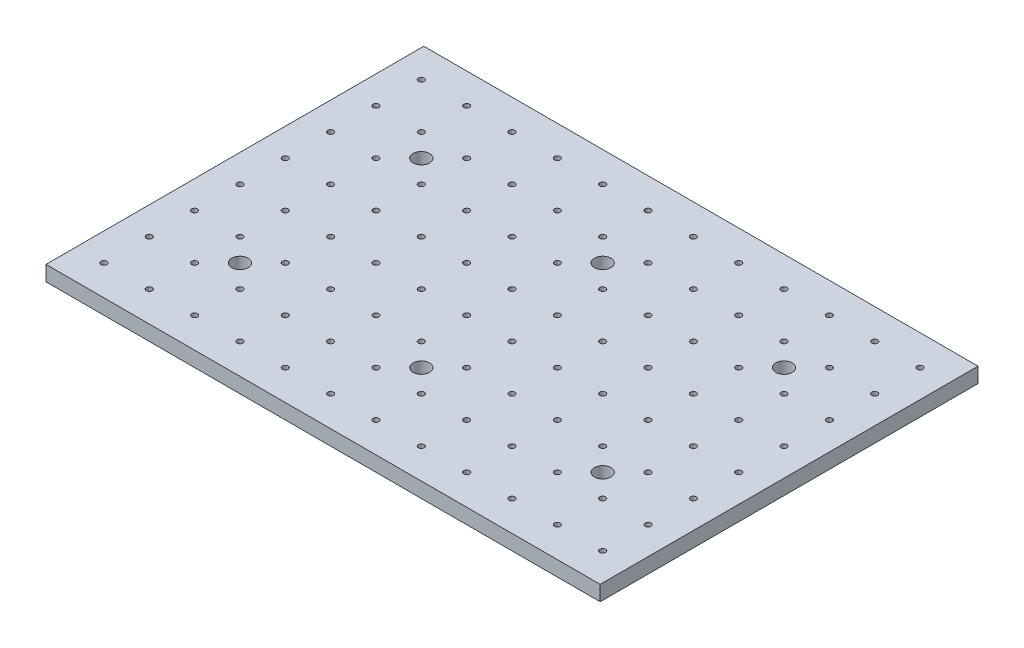
from build123d import *

# Parameters (mm, degrees)
SKETCH1_W                = 110
SKETCH1_H                = 75
BOSS_EXTRUDE1_DEPTH      = 3
SKETCH2_R                = 0.575
CUT_EXTRUDE2_DEPTH       = 67.635200908
LPATTERN1_COUNT          = 6
LPATTERN1_PITCH          = 9
LPATTERN1_COUNT_DIR2     = 4
LPATTERN1_PITCH_DIR2     = 9
MIRROR1_COPY_1_SKETCH_R  = 0.575
MIRROR1_COPY_1_DEPTH     = 67.635200908
MIRROR1_COPY_2_SKETCH_R  = 0.575
MIRROR1_COPY_2_DEPTH     = 67.635200908
MIRROR1_COPY_3_SKETCH_R  = 0.575
MIRROR1_COPY_3_DEPTH     = 67.635200908
MIRROR1_COPY_4_SKETCH_R  = 0.575
MIRROR1_COPY_4_DEPTH     = 67.635200908
MIRROR1_COPY_5_SKETCH_R  = 0.575
MIRROR1_COPY_5_DEPTH     = 67.635200908
MIRROR1_COPY_6_SKETCH_R  = 0.575
MIRROR1_COPY_6_DEPTH     = 67.635200908
MIRROR1_COPY_7_SKETCH_R  = 0.575
MIRROR1_COPY_7_DEPTH     = 67.635200908
MIRROR1_COPY_8_SKETCH_R  = 0.575
MIRROR1_COPY_8_DEPTH     = 67.635200908
MIRROR1_COPY_9_SKETCH_R  = 0.575
MIRROR1_COPY_9_DEPTH     = 67.635200908
MIRROR1_COPY_10_SKETCH_R = 0.575
MIRROR1_COPY_10_DEPTH    = 67.635200908
MIRROR1_COPY_11_SKETCH_R = 0.575
MIRROR1_COPY_11_DEPTH    = 67.635200908
MIRROR1_COPY_12_SKETCH_R = 0.575
MIRROR1_COPY_12_DEPTH    = 67.635200908
MIRROR1_COPY_13_SKETCH_R = 0.575
MIRROR1_COPY_13_DEPTH    = 67.635200908
MIRROR1_COPY_14_SKETCH_R = 0.575
MIRROR1_COPY_14_DEPTH    = 67.635200908
MIRROR1_COPY_15_SKETCH_R = 0.575
MIRROR1_COPY_15_DEPTH    = 67.635200908
MIRROR1_COPY_16_SKETCH_R = 0.575
MIRROR1_COPY_16_DEPTH    = 67.635200908
MIRROR1_COPY_17_SKETCH_R = 0.575
MIRROR1_COPY_17_DEPTH    = 67.635200908
MIRROR1_COPY_18_SKETCH_R = 0.575
MIRROR1_COPY_18_DEPTH    = 67.635200908
MIRROR1_COPY_19_SKETCH_R = 0.575
MIRROR1_COPY_19_DEPTH    = 67.635200908
MIRROR1_COPY_20_SKETCH_R = 0.575
MIRROR1_COPY_20_DEPTH    = 67.635200908
MIRROR1_COPY_21_SKETCH_R = 0.575
MIRROR1_COPY_21_DEPTH    = 67.635200908
MIRROR1_COPY_22_SKETCH_R = 0.575
MIRROR1_COPY_22_DEPTH    = 67.635200908
MIRROR1_COPY_23_SKETCH_R = 0.575
MIRROR1_COPY_23_DEPTH    = 67.635200908
MIRROR2_COPY_1_SKETCH_R  = 0.575
MIRROR2_COPY_1_DEPTH     = 67.635200908
MIRROR2_COPY_2_SKETCH_R  = 0.575
MIRROR2_COPY_2_DEPTH     = 67.635200908
MIRROR2_COPY_3_SKETCH_R  = 0.575
MIRROR2_COPY_3_DEPTH     = 67.635200908
MIRROR2_COPY_4_SKETCH_R  = 0.575
MIRROR2_COPY_4_DEPTH     = 67.635200908
MIRROR2_COPY_5_SKETCH_R  = 0.575
MIRROR2_COPY_5_DEPTH     = 67.635200908
MIRROR2_COPY_6_SKETCH_R  = 0.575
MIRROR2_COPY_6_DEPTH     = 67.635200908
MIRROR2_COPY_7_SKETCH_R  = 0.575
MIRROR2_COPY_7_DEPTH     = 67.635200908
MIRROR2_COPY_8_SKETCH_R  = 0.575
MIRROR2_COPY_8_DEPTH     = 67.635200908
MIRROR2_COPY_9_SKETCH_R  = 0.575
MIRROR2_COPY_9_DEPTH     = 67.635200908
MIRROR2_COPY_10_SKETCH_R = 0.575
MIRROR2_COPY_10_DEPTH    = 67.635200908
MIRROR2_COPY_11_SKETCH_R = 0.575
MIRROR2_COPY_11_DEPTH    = 67.635200908
MIRROR2_COPY_12_SKETCH_R = 0.575
MIRROR2_COPY_12_DEPTH    = 67.635200908
MIRROR2_COPY_13_SKETCH_R = 0.575
MIRROR2_COPY_13_DEPTH    = 67.635200908
MIRROR2_COPY_14_SKETCH_R = 0.575
MIRROR2_COPY_14_DEPTH    = 67.635200908
MIRROR2_COPY_15_SKETCH_R = 0.575
MIRROR2_COPY_15_DEPTH    = 67.635200908
MIRROR2_COPY_16_SKETCH_R = 0.575
MIRROR2_COPY_16_DEPTH    = 67.635200908
MIRROR2_COPY_17_SKETCH_R = 0.575
MIRROR2_COPY_17_DEPTH    = 67.635200908
MIRROR2_COPY_18_SKETCH_R = 0.575
MIRROR2_COPY_18_DEPTH    = 67.635200908
MIRROR2_COPY_19_SKETCH_R = 0.575
MIRROR2_COPY_19_DEPTH    = 67.635200908
MIRROR2_COPY_20_SKETCH_R = 0.575
MIRROR2_COPY_20_DEPTH    = 67.635200908
MIRROR2_COPY_21_SKETCH_R = 0.575
MIRROR2_COPY_21_DEPTH    = 67.635200908
MIRROR2_COPY_22_SKETCH_R = 0.575
MIRROR2_COPY_22_DEPTH    = 67.635200908
MIRROR2_COPY_23_SKETCH_R = 0.575
MIRROR2_COPY_23_DEPTH    = 67.635200908
MIRROR2_COPY_24_SKETCH_R = 0.575
MIRROR2_COPY_24_DEPTH    = 67.635200908
MIRROR2_COPY_25_SKETCH_R = 0.575
MIRROR2_COPY_25_DEPTH    = 67.635200908
MIRROR2_COPY_26_SKETCH_R = 0.575
MIRROR2_COPY_26_DEPTH    = 67.635200908
MIRROR2_COPY_27_SKETCH_R = 0.575
MIRROR2_COPY_27_DEPTH    = 67.635200908
MIRROR2_COPY_28_SKETCH_R = 0.575
MIRROR2_COPY_28_DEPTH    = 67.635200908
MIRROR2_COPY_29_SKETCH_R = 0.575
MIRROR2_COPY_29_DEPTH    = 67.635200908
MIRROR2_COPY_30_SKETCH_R = 0.575
MIRROR2_COPY_30_DEPTH    = 67.635200908
MIRROR2_COPY_31_SKETCH_R = 0.575
MIRROR2_COPY_31_DEPTH    = 67.635200908
MIRROR2_COPY_32_SKETCH_R = 0.575
MIRROR2_COPY_32_DEPTH    = 67.635200908
MIRROR2_COPY_33_SKETCH_R = 0.575
MIRROR2_COPY_33_DEPTH    = 67.635200908
MIRROR2_COPY_34_SKETCH_R = 0.575
MIRROR2_COPY_34_DEPTH    = 67.635200908
MIRROR2_COPY_35_SKETCH_R = 0.575
MIRROR2_COPY_35_DEPTH    = 67.635200908
MIRROR2_COPY_36_SKETCH_R = 0.575
MIRROR2_COPY_36_DEPTH    = 67.635200908
MIRROR2_COPY_37_SKETCH_R = 0.575
MIRROR2_COPY_37_DEPTH    = 67.635200908
MIRROR2_COPY_38_SKETCH_R = 0.575
MIRROR2_COPY_38_DEPTH    = 67.635200908
MIRROR2_COPY_39_SKETCH_R = 0.575
MIRROR2_COPY_39_DEPTH    = 67.635200908
MIRROR2_COPY_40_SKETCH_R = 0.575
MIRROR2_COPY_40_DEPTH    = 67.635200908
MIRROR2_COPY_41_SKETCH_R = 0.575
MIRROR2_COPY_41_DEPTH    = 67.635200908
MIRROR2_COPY_42_SKETCH_R = 0.575
MIRROR2_COPY_42_DEPTH    = 67.635200908
MIRROR2_COPY_43_SKETCH_R = 0.575
MIRROR2_COPY_43_DEPTH    = 67.635200908
MIRROR2_COPY_44_SKETCH_R = 0.575
MIRROR2_COPY_44_DEPTH    = 67.635200908
MIRROR2_COPY_45_SKETCH_R = 0.575
MIRROR2_COPY_45_DEPTH    = 67.635200908
MIRROR2_COPY_46_SKETCH_R = 0.575
MIRROR2_COPY_46_DEPTH    = 67.635200908
MIRROR2_COPY_47_SKETCH_R = 0.575
MIRROR2_COPY_47_DEPTH    = 67.635200908
F_4_CLEARANCE_HOLE1_D    = 3.2639


with BuildPart() as part:
    # Sketch1 → Boss-Extrude1 (new body)
    with BuildSketch(Plane(origin=(0, 0, 0), x_dir=(1, 0, 0), z_dir=(0, 1, 0))):
        Rectangle(SKETCH1_W, SKETCH1_H)
    extrude(amount=BOSS_EXTRUDE1_DEPTH)

    # Sketch2 → Cut-Extrude2 (cut, through all)
    with BuildSketch(Plane(origin=(0, 0, 0), x_dir=(1, 0, 0), z_dir=(0, 1, 0))):
        with Locations((-4.5, 4.5)):
            Circle(SKETCH2_R)
    cut_extrude2 = extrude(amount=CUT_EXTRUDE2_DEPTH, mode=Mode.SUBTRACT)

    # LPattern1: Cut-Extrude2 6 × 4
    with Locations(*[(-i * LPATTERN1_PITCH, 0, -j * LPATTERN1_PITCH_DIR2) for i in range(LPATTERN1_COUNT) for j in range(LPATTERN1_COUNT_DIR2) if (i, j) != (0, 0)]):
        add(cut_extrude2, mode=Mode.SUBTRACT)

    # Mirror1: Cut-Extrude2 across plane
    add(cut_extrude2.mirror(Plane.XY), mode=Mode.SUBTRACT)

    # Mirror1 copy 1 sketch → Mirror1 copy 1 (cut, through all)
    with BuildSketch(Plane(origin=(0, 0, 9), x_dir=(1, 0, 0), z_dir=(0, 1, 0))):
        with Locations((-4.5, -4.5)):
            Circle(MIRROR1_COPY_1_SKETCH_R)
    extrude(amount=MIRROR1_COPY_1_DEPTH, mode=Mode.SUBTRACT)

    # Mirror1 copy 2 sketch → Mirror1 copy 2 (cut, through all)
    with BuildSketch(Plane(origin=(0, 0, 18), x_dir=(1, 0, 0), z_dir=(0, 1, 0))):
        with Locations((-4.5, -4.5)):
            Circle(MIRROR1_COPY_2_SKETCH_R)
    extrude(amount=MIRROR1_COPY_2_DEPTH, mode=Mode.SUBTRACT)

    # Mirror1 copy 3 sketch → Mirror1 copy 3 (cut, through all)
    with BuildSketch(Plane(origin=(0, 0, 27), x_dir=(1, 0, 0), z_dir=(0, 1, 0))):
        with Locations((-4.5, -4.5)):
            Circle(MIRROR1_COPY_3_SKETCH_R)
    extrude(amount=MIRROR1_COPY_3_DEPTH, mode=Mode.SUBTRACT)

    # Mirror1 copy 4 sketch → Mirror1 copy 4 (cut, through all)
    with BuildSketch(Plane(origin=(-9, 0, 0), x_dir=(1, 0, 0), z_dir=(0, 1, 0))):
        with Locations((-4.5, -4.5)):
            Circle(MIRROR1_COPY_4_SKETCH_R)
    extrude(amount=MIRROR1_COPY_4_DEPTH, mode=Mode.SUBTRACT)

    # Mirror1 copy 5 sketch → Mirror1 copy 5 (cut, through all)
    with BuildSketch(Plane(origin=(-9, 0, 9), x_dir=(1, 0, 0), z_dir=(0, 1, 0))):
        with Locations((-4.5, -4.5)):
            Circle(MIRROR1_COPY_5_SKETCH_R)
    extrude(amount=MIRROR1_COPY_5_DEPTH, mode=Mode.SUBTRACT)

    # Mirror1 copy 6 sketch → Mirror1 copy 6 (cut, through all)
    with BuildSketch(Plane(origin=(-9, 0, 18), x_dir=(1, 0, 0), z_dir=(0, 1, 0))):
        with Locations((-4.5, -4.5)):
            Circle(MIRROR1_COPY_6_SKETCH_R)
    extrude(amount=MIRROR1_COPY_6_DEPTH, mode=Mode.SUBTRACT)

    # Mirror1 copy 7 sketch → Mirror1 copy 7 (cut, through all)
    with BuildSketch(Plane(origin=(-9, 0, 27), x_dir=(1, 0, 0), z_dir=(0, 1, 0))):
        with Locations((-4.5, -4.5)):
            Circle(MIRROR1_COPY_7_SKETCH_R)
    extrude(amount=MIRROR1_COPY_7_DEPTH, mode=Mode.SUBTRACT)

    # Mirror1 copy 8 sketch → Mirror1 copy 8 (cut, through all)
    with BuildSketch(Plane(origin=(-18, 0, 0), x_dir=(1, 0, 0), z_dir=(0, 1, 0))):
        with Locations((-4.5, -4.5)):
            Circle(MIRROR1_COPY_8_SKETCH_R)
    extrude(amount=MIRROR1_COPY_8_DEPTH, mode=Mode.SUBTRACT)

    # Mirror1 copy 9 sketch → Mirror1 copy 9 (cut, through all)
    with BuildSketch(Plane(origin=(-18, 0, 9), x_dir=(1, 0, 0), z_dir=(0, 1, 0))):
        with Locations((-4.5, -4.5)):
            Circle(MIRROR1_COPY_9_SKETCH_R)
    extrude(amount=MIRROR1_COPY_9_DEPTH, mode=Mode.SUBTRACT)

    # Mirror1 copy 10 sketch → Mirror1 copy 10 (cut, through all)
    with BuildSketch(Plane(origin=(-18, 0, 18), x_dir=(1, 0, 0), z_dir=(0, 1, 0))):
        with Locations((-4.5, -4.5)):
            Circle(MIRROR1_COPY_10_SKETCH_R)
    extrude(amount=MIRROR1_COPY_10_DEPTH, mode=Mode.SUBTRACT)

    # Mirror1 copy 11 sketch → Mirror1 copy 11 (cut, through all)
    with BuildSketch(Plane(origin=(-18, 0, 27), x_dir=(1, 0, 0), z_dir=(0, 1, 0))):
        with Locations((-4.5, -4.5)):
            Circle(MIRROR1_COPY_11_SKETCH_R)
    extrude(amount=MIRROR1_COPY_11_DEPTH, mode=Mode.SUBTRACT)

    # Mirror1 copy 12 sketch → Mirror1 copy 12 (cut, through all)
    with BuildSketch(Plane(origin=(-27, 0, 0), x_dir=(1, 0, 0), z_dir=(0, 1, 0))):
        with Locations((-4.5, -4.5)):
            Circle(MIRROR1_COPY_12_SKETCH_R)
    extrude(amount=MIRROR1_COPY_12_DEPTH, mode=Mode.SUBTRACT)

    # Mirror1 copy 13 sketch → Mirror1 copy 13 (cut, through all)
    with BuildSketch(Plane(origin=(-27, 0, 9), x_dir=(1, 0, 0), z_dir=(0, 1, 0))):
        with Locations((-4.5, -4.5)):
            Circle(MIRROR1_COPY_13_SKETCH_R)
    extrude(amount=MIRROR1_COPY_13_DEPTH, mode=Mode.SUBTRACT)

    # Mirror1 copy 14 sketch → Mirror1 copy 14 (cut, through all)
    with BuildSketch(Plane(origin=(-27, 0, 18), x_dir=(1, 0, 0), z_dir=(0, 1, 0))):
        with Locations((-4.5, -4.5)):
            Circle(MIRROR1_COPY_14_SKETCH_R)
    extrude(amount=MIRROR1_COPY_14_DEPTH, mode=Mode.SUBTRACT)

    # Mirror1 copy 15 sketch → Mirror1 copy 15 (cut, through all)
    with BuildSketch(Plane(origin=(-27, 0, 27), x_dir=(1, 0, 0), z_dir=(0, 1, 0))):
        with Locations((-4.5, -4.5)):
            Circle(MIRROR1_COPY_15_SKETCH_R)
    extrude(amount=MIRROR1_COPY_15_DEPTH, mode=Mode.SUBTRACT)

    # Mirror1 copy 16 sketch → Mirror1 copy 16 (cut, through all)
    with BuildSketch(Plane(origin=(-36, 0, 0), x_dir=(1, 0, 0), z_dir=(0, 1, 0))):
        with Locations((-4.5, -4.5)):
            Circle(MIRROR1_COPY_16_SKETCH_R)
    extrude(amount=MIRROR1_COPY_16_DEPTH, mode=Mode.SUBTRACT)

    # Mirror1 copy 17 sketch → Mirror1 copy 17 (cut, through all)
    with BuildSketch(Plane(origin=(-36, 0, 9), x_dir=(1, 0, 0), z_dir=(0, 1, 0))):
        with Locations((-4.5, -4.5)):
            Circle(MIRROR1_COPY_17_SKETCH_R)
    extrude(amount=MIRROR1_COPY_17_DEPTH, mode=Mode.SUBTRACT)

    # Mirror1 copy 18 sketch → Mirror1 copy 18 (cut, through all)
    with BuildSketch(Plane(origin=(-36, 0, 18), x_dir=(1, 0, 0), z_dir=(0, 1, 0))):
        with Locations((-4.5, -4.5)):
            Circle(MIRROR1_COPY_18_SKETCH_R)
    extrude(amount=MIRROR1_COPY_18_DEPTH, mode=Mode.SUBTRACT)

    # Mirror1 copy 19 sketch → Mirror1 copy 19 (cut, through all)
    with BuildSketch(Plane(origin=(-36, 0, 27), x_dir=(1, 0, 0), z_dir=(0, 1, 0))):
        with Locations((-4.5, -4.5)):
            Circle(MIRROR1_COPY_19_SKETCH_R)
    extrude(amount=MIRROR1_COPY_19_DEPTH, mode=Mode.SUBTRACT)

    # Mirror1 copy 20 sketch → Mirror1 copy 20 (cut, through all)
    with BuildSketch(Plane(origin=(-45, 0, 0), x_dir=(1, 0, 0), z_dir=(0, 1, 0))):
        with Locations((-4.5, -4.5)):
            Circle(MIRROR1_COPY_20_SKETCH_R)
    extrude(amount=MIRROR1_COPY_20_DEPTH, mode=Mode.SUBTRACT)

    # Mirror1 copy 21 sketch → Mirror1 copy 21 (cut, through all)
    with BuildSketch(Plane(origin=(-45, 0, 9), x_dir=(1, 0, 0), z_dir=(0, 1, 0))):
        with Locations((-4.5, -4.5)):
            Circle(MIRROR1_COPY_21_SKETCH_R)
    extrude(amount=MIRROR1_COPY_21_DEPTH, mode=Mode.SUBTRACT)

    # Mirror1 copy 22 sketch → Mirror1 copy 22 (cut, through all)
    with BuildSketch(Plane(origin=(-45, 0, 18), x_dir=(1, 0, 0), z_dir=(0, 1, 0))):
        with Locations((-4.5, -4.5)):
            Circle(MIRROR1_COPY_22_SKETCH_R)
    extrude(amount=MIRROR1_COPY_22_DEPTH, mode=Mode.SUBTRACT)

    # Mirror1 copy 23 sketch → Mirror1 copy 23 (cut, through all)
    with BuildSketch(Plane(origin=(-45, 0, 27), x_dir=(1, 0, 0), z_dir=(0, 1, 0))):
        with Locations((-4.5, -4.5)):
            Circle(MIRROR1_COPY_23_SKETCH_R)
    extrude(amount=MIRROR1_COPY_23_DEPTH, mode=Mode.SUBTRACT)

    # Mirror2: Cut-Extrude2 across plane
    add(cut_extrude2.mirror(Plane(origin=(0, 0, 0), x_dir=(0, 0, 1), z_dir=(1, 0, 0))), mode=Mode.SUBTRACT)

    # Mirror2 copy 1 sketch → Mirror2 copy 1 (cut, through all)
    with BuildSketch(Plane(origin=(0, 0, -9), x_dir=(-1, 0, 0), z_dir=(0, 1, 0))):
        with Locations((-4.5, -4.5)):
            Circle(MIRROR2_COPY_1_SKETCH_R)
    extrude(amount=MIRROR2_COPY_1_DEPTH, mode=Mode.SUBTRACT)

    # Mirror2 copy 2 sketch → Mirror2 copy 2 (cut, through all)
    with BuildSketch(Plane(origin=(0, 0, -18), x_dir=(-1, 0, 0), z_dir=(0, 1, 0))):
        with Locations((-4.5, -4.5)):
            Circle(MIRROR2_COPY_2_SKETCH_R)
    extrude(amount=MIRROR2_COPY_2_DEPTH, mode=Mode.SUBTRACT)

    # Mirror2 copy 3 sketch → Mirror2 copy 3 (cut, through all)
    with BuildSketch(Plane(origin=(0, 0, -27), x_dir=(-1, 0, 0), z_dir=(0, 1, 0))):
        with Locations((-4.5, -4.5)):
            Circle(MIRROR2_COPY_3_SKETCH_R)
    extrude(amount=MIRROR2_COPY_3_DEPTH, mode=Mode.SUBTRACT)

    # Mirror2 copy 4 sketch → Mirror2 copy 4 (cut, through all)
    with BuildSketch(Plane(origin=(9, 0, 0), x_dir=(-1, 0, 0), z_dir=(0, 1, 0))):
        with Locations((-4.5, -4.5)):
            Circle(MIRROR2_COPY_4_SKETCH_R)
    extrude(amount=MIRROR2_COPY_4_DEPTH, mode=Mode.SUBTRACT)

    # Mirror2 copy 5 sketch → Mirror2 copy 5 (cut, through all)
    with BuildSketch(Plane(origin=(9, 0, -9), x_dir=(-1, 0, 0), z_dir=(0, 1, 0))):
        with Locations((-4.5, -4.5)):
            Circle(MIRROR2_COPY_5_SKETCH_R)
    extrude(amount=MIRROR2_COPY_5_DEPTH, mode=Mode.SUBTRACT)

    # Mirror2 copy 6 sketch → Mirror2 copy 6 (cut, through all)
    with BuildSketch(Plane(origin=(9, 0, -18), x_dir=(-1, 0, 0), z_dir=(0, 1, 0))):
        with Locations((-4.5, -4.5)):
            Circle(MIRROR2_COPY_6_SKETCH_R)
    extrude(amount=MIRROR2_COPY_6_DEPTH, mode=Mode.SUBTRACT)

    # Mirror2 copy 7 sketch → Mirror2 copy 7 (cut, through all)
    with BuildSketch(Plane(origin=(9, 0, -27), x_dir=(-1, 0, 0), z_dir=(0, 1, 0))):
        with Locations((-4.5, -4.5)):
            Circle(MIRROR2_COPY_7_SKETCH_R)
    extrude(amount=MIRROR2_COPY_7_DEPTH, mode=Mode.SUBTRACT)

    # Mirror2 copy 8 sketch → Mirror2 copy 8 (cut, through all)
    with BuildSketch(Plane(origin=(18, 0, 0), x_dir=(-1, 0, 0), z_dir=(0, 1, 0))):
        with Locations((-4.5, -4.5)):
            Circle(MIRROR2_COPY_8_SKETCH_R)
    extrude(amount=MIRROR2_COPY_8_DEPTH, mode=Mode.SUBTRACT)

    # Mirror2 copy 9 sketch → Mirror2 copy 9 (cut, through all)
    with BuildSketch(Plane(origin=(18, 0, -9), x_dir=(-1, 0, 0), z_dir=(0, 1, 0))):
        with Locations((-4.5, -4.5)):
            Circle(MIRROR2_COPY_9_SKETCH_R)
    extrude(amount=MIRROR2_COPY_9_DEPTH, mode=Mode.SUBTRACT)

    # Mirror2 copy 10 sketch → Mirror2 copy 10 (cut, through all)
    with BuildSketch(Plane(origin=(18, 0, -18), x_dir=(-1, 0, 0), z_dir=(0, 1, 0))):
        with Locations((-4.5, -4.5)):
            Circle(MIRROR2_COPY_10_SKETCH_R)
    extrude(amount=MIRROR2_COPY_10_DEPTH, mode=Mode.SUBTRACT)

    # Mirror2 copy 11 sketch → Mirror2 copy 11 (cut, through all)
    with BuildSketch(Plane(origin=(18, 0, -27), x_dir=(-1, 0, 0), z_dir=(0, 1, 0))):
        with Locations((-4.5, -4.5)):
            Circle(MIRROR2_COPY_11_SKETCH_R)
    extrude(amount=MIRROR2_COPY_11_DEPTH, mode=Mode.SUBTRACT)

    # Mirror2 copy 12 sketch → Mirror2 copy 12 (cut, through all)
    with BuildSketch(Plane(origin=(27, 0, 0), x_dir=(-1, 0, 0), z_dir=(0, 1, 0))):
        with Locations((-4.5, -4.5)):
            Circle(MIRROR2_COPY_12_SKETCH_R)
    extrude(amount=MIRROR2_COPY_12_DEPTH, mode=Mode.SUBTRACT)

    # Mirror2 copy 13 sketch → Mirror2 copy 13 (cut, through all)
    with BuildSketch(Plane(origin=(27, 0, -9), x_dir=(-1, 0, 0), z_dir=(0, 1, 0))):
        with Locations((-4.5, -4.5)):
            Circle(MIRROR2_COPY_13_SKETCH_R)
    extrude(amount=MIRROR2_COPY_13_DEPTH, mode=Mode.SUBTRACT)

    # Mirror2 copy 14 sketch → Mirror2 copy 14 (cut, through all)
    with BuildSketch(Plane(origin=(27, 0, -18), x_dir=(-1, 0, 0), z_dir=(0, 1, 0))):
        with Locations((-4.5, -4.5)):
            Circle(MIRROR2_COPY_14_SKETCH_R)
    extrude(amount=MIRROR2_COPY_14_DEPTH, mode=Mode.SUBTRACT)

    # Mirror2 copy 15 sketch → Mirror2 copy 15 (cut, through all)
    with BuildSketch(Plane(origin=(27, 0, -27), x_dir=(-1, 0, 0), z_dir=(0, 1, 0))):
        with Locations((-4.5, -4.5)):
            Circle(MIRROR2_COPY_15_SKETCH_R)
    extrude(amount=MIRROR2_COPY_15_DEPTH, mode=Mode.SUBTRACT)

    # Mirror2 copy 16 sketch → Mirror2 copy 16 (cut, through all)
    with BuildSketch(Plane(origin=(36, 0, 0), x_dir=(-1, 0, 0), z_dir=(0, 1, 0))):
        with Locations((-4.5, -4.5)):
            Circle(MIRROR2_COPY_16_SKETCH_R)
    extrude(amount=MIRROR2_COPY_16_DEPTH, mode=Mode.SUBTRACT)

    # Mirror2 copy 17 sketch → Mirror2 copy 17 (cut, through all)
    with BuildSketch(Plane(origin=(36, 0, -9), x_dir=(-1, 0, 0), z_dir=(0, 1, 0))):
        with Locations((-4.5, -4.5)):
            Circle(MIRROR2_COPY_17_SKETCH_R)
    extrude(amount=MIRROR2_COPY_17_DEPTH, mode=Mode.SUBTRACT)

    # Mirror2 copy 18 sketch → Mirror2 copy 18 (cut, through all)
    with BuildSketch(Plane(origin=(36, 0, -18), x_dir=(-1, 0, 0), z_dir=(0, 1, 0))):
        with Locations((-4.5, -4.5)):
            Circle(MIRROR2_COPY_18_SKETCH_R)
    extrude(amount=MIRROR2_COPY_18_DEPTH, mode=Mode.SUBTRACT)

    # Mirror2 copy 19 sketch → Mirror2 copy 19 (cut, through all)
    with BuildSketch(Plane(origin=(36, 0, -27), x_dir=(-1, 0, 0), z_dir=(0, 1, 0))):
        with Locations((-4.5, -4.5)):
            Circle(MIRROR2_COPY_19_SKETCH_R)
    extrude(amount=MIRROR2_COPY_19_DEPTH, mode=Mode.SUBTRACT)

    # Mirror2 copy 20 sketch → Mirror2 copy 20 (cut, through all)
    with BuildSketch(Plane(origin=(45, 0, 0), x_dir=(-1, 0, 0), z_dir=(0, 1, 0))):
        with Locations((-4.5, -4.5)):
            Circle(MIRROR2_COPY_20_SKETCH_R)
    extrude(amount=MIRROR2_COPY_20_DEPTH, mode=Mode.SUBTRACT)

    # Mirror2 copy 21 sketch → Mirror2 copy 21 (cut, through all)
    with BuildSketch(Plane(origin=(45, 0, -9), x_dir=(-1, 0, 0), z_dir=(0, 1, 0))):
        with Locations((-4.5, -4.5)):
            Circle(MIRROR2_COPY_21_SKETCH_R)
    extrude(amount=MIRROR2_COPY_21_DEPTH, mode=Mode.SUBTRACT)

    # Mirror2 copy 22 sketch → Mirror2 copy 22 (cut, through all)
    with BuildSketch(Plane(origin=(45, 0, -18), x_dir=(-1, 0, 0), z_dir=(0, 1, 0))):
        with Locations((-4.5, -4.5)):
            Circle(MIRROR2_COPY_22_SKETCH_R)
    extrude(amount=MIRROR2_COPY_22_DEPTH, mode=Mode.SUBTRACT)

    # Mirror2 copy 23 sketch → Mirror2 copy 23 (cut, through all)
    with BuildSketch(Plane(origin=(45, 0, -27), x_dir=(-1, 0, 0), z_dir=(0, 1, 0))):
        with Locations((-4.5, -4.5)):
            Circle(MIRROR2_COPY_23_SKETCH_R)
    extrude(amount=MIRROR2_COPY_23_DEPTH, mode=Mode.SUBTRACT)

    # Mirror2 copy 24 sketch → Mirror2 copy 24 (cut, through all)
    with BuildSketch(Plane(origin=(0, 0, 0), x_dir=(-1, 0, 0), z_dir=(0, 1, 0))):
        with Locations((-4.5, 4.5)):
            Circle(MIRROR2_COPY_24_SKETCH_R)
    extrude(amount=MIRROR2_COPY_24_DEPTH, mode=Mode.SUBTRACT)

    # Mirror2 copy 25 sketch → Mirror2 copy 25 (cut, through all)
    with BuildSketch(Plane(origin=(0, 0, 9), x_dir=(-1, 0, 0), z_dir=(0, 1, 0))):
        with Locations((-4.5, 4.5)):
            Circle(MIRROR2_COPY_25_SKETCH_R)
    extrude(amount=MIRROR2_COPY_25_DEPTH, mode=Mode.SUBTRACT)

    # Mirror2 copy 26 sketch → Mirror2 copy 26 (cut, through all)
    with BuildSketch(Plane(origin=(0, 0, 18), x_dir=(-1, 0, 0), z_dir=(0, 1, 0))):
        with Locations((-4.5, 4.5)):
            Circle(MIRROR2_COPY_26_SKETCH_R)
    extrude(amount=MIRROR2_COPY_26_DEPTH, mode=Mode.SUBTRACT)

    # Mirror2 copy 27 sketch → Mirror2 copy 27 (cut, through all)
    with BuildSketch(Plane(origin=(0, 0, 27), x_dir=(-1, 0, 0), z_dir=(0, 1, 0))):
        with Locations((-4.5, 4.5)):
            Circle(MIRROR2_COPY_27_SKETCH_R)
    extrude(amount=MIRROR2_COPY_27_DEPTH, mode=Mode.SUBTRACT)

    # Mirror2 copy 28 sketch → Mirror2 copy 28 (cut, through all)
    with BuildSketch(Plane(origin=(9, 0, 0), x_dir=(-1, 0, 0), z_dir=(0, 1, 0))):
        with Locations((-4.5, 4.5)):
            Circle(MIRROR2_COPY_28_SKETCH_R)
    extrude(amount=MIRROR2_COPY_28_DEPTH, mode=Mode.SUBTRACT)

    # Mirror2 copy 29 sketch → Mirror2 copy 29 (cut, through all)
    with BuildSketch(Plane(origin=(9, 0, 9), x_dir=(-1, 0, 0), z_dir=(0, 1, 0))):
        with Locations((-4.5, 4.5)):
            Circle(MIRROR2_COPY_29_SKETCH_R)
    extrude(amount=MIRROR2_COPY_29_DEPTH, mode=Mode.SUBTRACT)

    # Mirror2 copy 30 sketch → Mirror2 copy 30 (cut, through all)
    with BuildSketch(Plane(origin=(9, 0, 18), x_dir=(-1, 0, 0), z_dir=(0, 1, 0))):
        with Locations((-4.5, 4.5)):
            Circle(MIRROR2_COPY_30_SKETCH_R)
    extrude(amount=MIRROR2_COPY_30_DEPTH, mode=Mode.SUBTRACT)

    # Mirror2 copy 31 sketch → Mirror2 copy 31 (cut, through all)
    with BuildSketch(Plane(origin=(9, 0, 27), x_dir=(-1, 0, 0), z_dir=(0, 1, 0))):
        with Locations((-4.5, 4.5)):
            Circle(MIRROR2_COPY_31_SKETCH_R)
    extrude(amount=MIRROR2_COPY_31_DEPTH, mode=Mode.SUBTRACT)

    # Mirror2 copy 32 sketch → Mirror2 copy 32 (cut, through all)
    with BuildSketch(Plane(origin=(18, 0, 0), x_dir=(-1, 0, 0), z_dir=(0, 1, 0))):
        with Locations((-4.5, 4.5)):
            Circle(MIRROR2_COPY_32_SKETCH_R)
    extrude(amount=MIRROR2_COPY_32_DEPTH, mode=Mode.SUBTRACT)

    # Mirror2 copy 33 sketch → Mirror2 copy 33 (cut, through all)
    with BuildSketch(Plane(origin=(18, 0, 9), x_dir=(-1, 0, 0), z_dir=(0, 1, 0))):
        with Locations((-4.5, 4.5)):
            Circle(MIRROR2_COPY_33_SKETCH_R)
    extrude(amount=MIRROR2_COPY_33_DEPTH, mode=Mode.SUBTRACT)

    # Mirror2 copy 34 sketch → Mirror2 copy 34 (cut, through all)
    with BuildSketch(Plane(origin=(18, 0, 18), x_dir=(-1, 0, 0), z_dir=(0, 1, 0))):
        with Locations((-4.5, 4.5)):
            Circle(MIRROR2_COPY_34_SKETCH_R)
    extrude(amount=MIRROR2_COPY_34_DEPTH, mode=Mode.SUBTRACT)

    # Mirror2 copy 35 sketch → Mirror2 copy 35 (cut, through all)
    with BuildSketch(Plane(origin=(18, 0, 27), x_dir=(-1, 0, 0), z_dir=(0, 1, 0))):
        with Locations((-4.5, 4.5)):
            Circle(MIRROR2_COPY_35_SKETCH_R)
    extrude(amount=MIRROR2_COPY_35_DEPTH, mode=Mode.SUBTRACT)

    # Mirror2 copy 36 sketch → Mirror2 copy 36 (cut, through all)
    with BuildSketch(Plane(origin=(27, 0, 0), x_dir=(-1, 0, 0), z_dir=(0, 1, 0))):
        with Locations((-4.5, 4.5)):
            Circle(MIRROR2_COPY_36_SKETCH_R)
    extrude(amount=MIRROR2_COPY_36_DEPTH, mode=Mode.SUBTRACT)

    # Mirror2 copy 37 sketch → Mirror2 copy 37 (cut, through all)
    with BuildSketch(Plane(origin=(27, 0, 9), x_dir=(-1, 0, 0), z_dir=(0, 1, 0))):
        with Locations((-4.5, 4.5)):
            Circle(MIRROR2_COPY_37_SKETCH_R)
    extrude(amount=MIRROR2_COPY_37_DEPTH, mode=Mode.SUBTRACT)

    # Mirror2 copy 38 sketch → Mirror2 copy 38 (cut, through all)
    with BuildSketch(Plane(origin=(27, 0, 18), x_dir=(-1, 0, 0), z_dir=(0, 1, 0))):
        with Locations((-4.5, 4.5)):
            Circle(MIRROR2_COPY_38_SKETCH_R)
    extrude(amount=MIRROR2_COPY_38_DEPTH, mode=Mode.SUBTRACT)

    # Mirror2 copy 39 sketch → Mirror2 copy 39 (cut, through all)
    with BuildSketch(Plane(origin=(27, 0, 27), x_dir=(-1, 0, 0), z_dir=(0, 1, 0))):
        with Locations((-4.5, 4.5)):
            Circle(MIRROR2_COPY_39_SKETCH_R)
    extrude(amount=MIRROR2_COPY_39_DEPTH, mode=Mode.SUBTRACT)

    # Mirror2 copy 40 sketch → Mirror2 copy 40 (cut, through all)
    with BuildSketch(Plane(origin=(36, 0, 0), x_dir=(-1, 0, 0), z_dir=(0, 1, 0))):
        with Locations((-4.5, 4.5)):
            Circle(MIRROR2_COPY_40_SKETCH_R)
    extrude(amount=MIRROR2_COPY_40_DEPTH, mode=Mode.SUBTRACT)

    # Mirror2 copy 41 sketch → Mirror2 copy 41 (cut, through all)
    with BuildSketch(Plane(origin=(36, 0, 9), x_dir=(-1, 0, 0), z_dir=(0, 1, 0))):
        with Locations((-4.5, 4.5)):
            Circle(MIRROR2_COPY_41_SKETCH_R)
    extrude(amount=MIRROR2_COPY_41_DEPTH, mode=Mode.SUBTRACT)

    # Mirror2 copy 42 sketch → Mirror2 copy 42 (cut, through all)
    with BuildSketch(Plane(origin=(36, 0, 18), x_dir=(-1, 0, 0), z_dir=(0, 1, 0))):
        with Locations((-4.5, 4.5)):
            Circle(MIRROR2_COPY_42_SKETCH_R)
    extrude(amount=MIRROR2_COPY_42_DEPTH, mode=Mode.SUBTRACT)

    # Mirror2 copy 43 sketch → Mirror2 copy 43 (cut, through all)
    with BuildSketch(Plane(origin=(36, 0, 27), x_dir=(-1, 0, 0), z_dir=(0, 1, 0))):
        with Locations((-4.5, 4.5)):
            Circle(MIRROR2_COPY_43_SKETCH_R)
    extrude(amount=MIRROR2_COPY_43_DEPTH, mode=Mode.SUBTRACT)

    # Mirror2 copy 44 sketch → Mirror2 copy 44 (cut, through all)
    with BuildSketch(Plane(origin=(45, 0, 0), x_dir=(-1, 0, 0), z_dir=(0, 1, 0))):
        with Locations((-4.5, 4.5)):
            Circle(MIRROR2_COPY_44_SKETCH_R)
    extrude(amount=MIRROR2_COPY_44_DEPTH, mode=Mode.SUBTRACT)

    # Mirror2 copy 45 sketch → Mirror2 copy 45 (cut, through all)
    with BuildSketch(Plane(origin=(45, 0, 9), x_dir=(-1, 0, 0), z_dir=(0, 1, 0))):
        with Locations((-4.5, 4.5)):
            Circle(MIRROR2_COPY_45_SKETCH_R)
    extrude(amount=MIRROR2_COPY_45_DEPTH, mode=Mode.SUBTRACT)

    # Mirror2 copy 46 sketch → Mirror2 copy 46 (cut, through all)
    with BuildSketch(Plane(origin=(45, 0, 18), x_dir=(-1, 0, 0), z_dir=(0, 1, 0))):
        with Locations((-4.5, 4.5)):
            Circle(MIRROR2_COPY_46_SKETCH_R)
    extrude(amount=MIRROR2_COPY_46_DEPTH, mode=Mode.SUBTRACT)

    # Mirror2 copy 47 sketch → Mirror2 copy 47 (cut, through all)
    with BuildSketch(Plane(origin=(45, 0, 27), x_dir=(-1, 0, 0), z_dir=(0, 1, 0))):
        with Locations((-4.5, 4.5)):
            Circle(MIRROR2_COPY_47_SKETCH_R)
    extrude(amount=MIRROR2_COPY_47_DEPTH, mode=Mode.SUBTRACT)

    # #4 Clearance Hole1 (through all)
    with Locations(Plane(origin=(0, 3, 0), x_dir=(1, 0, 0), z_dir=(0, 1, 0))):
        with Locations((-36, 18), (36, -18), (36, 18), (-36, -18), (0, 18), (0, -18)):
            Hole(F_4_CLEARANCE_HOLE1_D / 2)


solid = part.part
